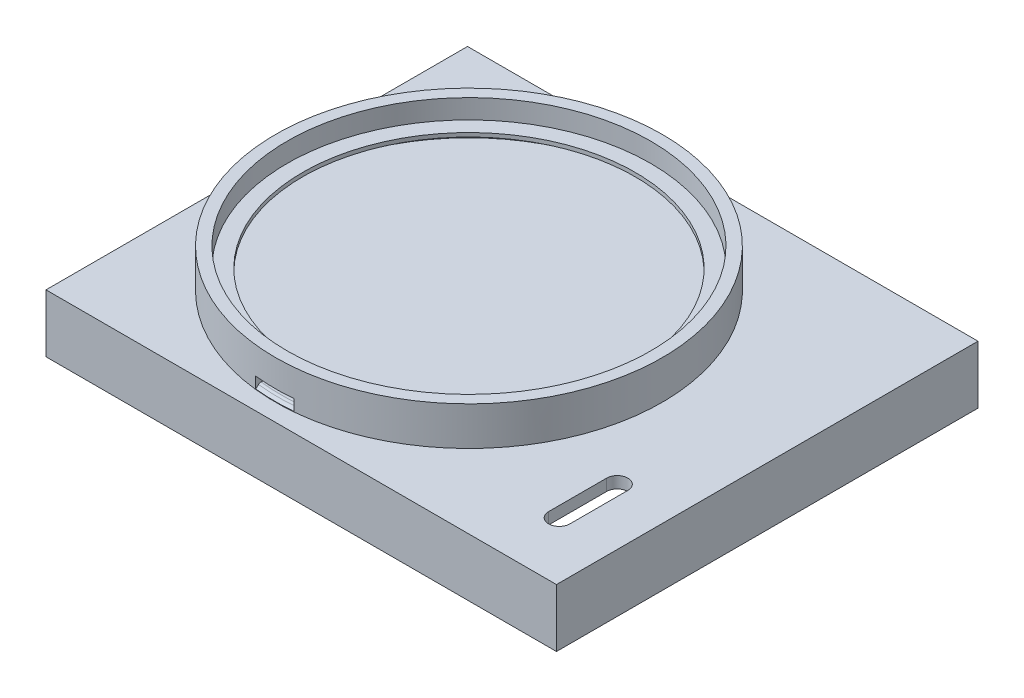
from build123d import *

# Parameters (mm, degrees)
SKETCH1_W            = 132
SKETCH1_H            = 109
BOSS_EXTRUDE1_DEPTH  = 15
SKETCH2_W            = 126
SKETCH2_H            = 103
CUT_EXTRUDE1_DEPTH   = 12
SKETCH3_W            = 18
SKETCH3_H            = 1.5
BOSS_EXTRUDE6_DEPTH  = 3
SKETCH6_W            = 18
SKETCH6_H            = 1.5
BOSS_EXTRUDE7_DEPTH  = 3
CUT_EXTRUDE2_DEPTH   = 10
SKETCH13_R           = 50
BOSS_EXTRUDE10_DEPTH = 4
SKETCH18_R           = 47
CUT_EXTRUDE6_DEPTH   = 3
SKETCH19_R           = 50
BOSS_EXTRUDE11_DEPTH = 6
SKETCH20_R           = 47
CUT_EXTRUDE7_DEPTH   = 5
SKETCH21_R           = 43
CUT_EXTRUDE8_DEPTH   = 3
SKETCH22_W           = 10
SKETCH22_H           = 2
CUT_EXTRUDE10_DEPTH  = 8.2
CHAMFER2_SIZE        = 1.3
CHAMFER2_SIZE2       = 0.9102698
FILLET2_R            = 1
SKETCH23_W           = 10
SKETCH23_H           = 2
CUT_EXTRUDE11_DEPTH  = 8.2
CHAMFER3_SIZE        = 1
CHAMFER3_SIZE2       = 0.869286738
FILLET3_R            = 1
SKETCH24_W           = 10
SKETCH24_H           = 2
CUT_EXTRUDE12_DEPTH  = 8.2
CHAMFER4_SIZE        = 1
CHAMFER4_SIZE2       = 0.869286738
FILLET4_R            = 1


with BuildPart() as part:
    # Sketch1 → Boss-Extrude1 (new body)
    with BuildSketch(Plane(origin=(0, 0, 0), x_dir=(1, 0, 0), z_dir=(0, 1, 0))):
        Rectangle(SKETCH1_W, SKETCH1_H)
    extrude(amount=BOSS_EXTRUDE1_DEPTH)

    # Sketch2 → Cut-Extrude1 (cut)
    with BuildSketch(Plane.XZ):
        Rectangle(SKETCH2_W, SKETCH2_H)
    extrude(amount=-CUT_EXTRUDE1_DEPTH, mode=Mode.SUBTRACT)

    # Sketch3 → Boss-Extrude6 (add)
    with BuildSketch(Plane(origin=(-63, 0, 0), x_dir=(0, 0, -1), z_dir=(1, 0, 0))):
        with Locations((0, 2)):
            Rectangle(SKETCH3_W, SKETCH3_H)
    extrude(amount=BOSS_EXTRUDE6_DEPTH)

    # Sketch6 → Boss-Extrude7 (add)
    with BuildSketch(Plane.ZY.offset(-63)):
        with Locations((0, 2)):
            Rectangle(SKETCH6_W, SKETCH6_H)
    extrude(amount=BOSS_EXTRUDE7_DEPTH)

    # Sketch14 → Cut-Extrude2 (cut)
    with BuildSketch(Plane(origin=(0, 15, 0), x_dir=(1, 0, 0), z_dir=(0, 1, 0))):
        with BuildLine():
            Line((48.646447832, -24.177866046), (48.646447832, -39.177866046))
            ThreePointArc((48.646447832, -39.177866046), (51.396447832, -41.927866046), (54.146447832, -39.177866046))
            Line((54.146447832, -39.177866046), (54.146447832, -24.177866046))
            ThreePointArc((54.146447832, -24.177866046), (51.396447832, -21.427866046), (48.646447832, -24.177866046))
        make_face()
    extrude(amount=-CUT_EXTRUDE2_DEPTH, mode=Mode.SUBTRACT)

    # Sketch13 → Boss-Extrude10 (add)
    with BuildSketch(Plane(origin=(0, 15, 0), x_dir=(1, 0, 0), z_dir=(0, 1, 0))):
        with Locations(Location((-11.133590864, 0, 0), (0, 0, 90))):
            Circle(SKETCH13_R)
    extrude(amount=BOSS_EXTRUDE10_DEPTH)

    # Sketch18 → Cut-Extrude6 (cut)
    with BuildSketch(Plane(origin=(0, 19, 0), x_dir=(1, 0, 0), z_dir=(0, 1, 0))):
        with Locations(Location((-11.133590864, 0, 0), (0, 0, 270))):
            Circle(SKETCH18_R)
    extrude(amount=-CUT_EXTRUDE6_DEPTH, mode=Mode.SUBTRACT)

    # Sketch19 → Boss-Extrude11 (add)
    with BuildSketch(Plane(origin=(0, 19, 0), x_dir=(1, 0, 0), z_dir=(0, 1, 0))):
        with Locations(Location((-11.133590864, 0, 0), (0, 0, 90))):
            Circle(SKETCH19_R)
    extrude(amount=BOSS_EXTRUDE11_DEPTH)

    # Sketch20 → Cut-Extrude7 (cut)
    with BuildSketch(Plane(origin=(0, 25, 0), x_dir=(1, 0, 0), z_dir=(0, 1, 0))):
        with Locations(Location((-11.133590864, 0, 0), (0, 0, 270))):
            Circle(SKETCH20_R)
    extrude(amount=-CUT_EXTRUDE7_DEPTH, mode=Mode.SUBTRACT)

    # Sketch21 → Cut-Extrude8 (cut)
    with BuildSketch(Plane(origin=(0, 20, 0), x_dir=(1, 0, 0), z_dir=(0, 1, 0))):
        with Locations(Location((-11.133590864, 0, 0), (0, 0, 270))):
            Circle(SKETCH21_R)
    extrude(amount=-CUT_EXTRUDE8_DEPTH, mode=Mode.SUBTRACT)

    # Sketch22 → Cut-Extrude10 (cut)
    with BuildSketch(Plane.ZY.offset(66)):
        with Locations((0, 16.991930037)):
            Rectangle(SKETCH22_W, SKETCH22_H)
    extrude(amount=-CUT_EXTRUDE10_DEPTH, mode=Mode.SUBTRACT)

    # Chamfer2
    chamfer2_edges = [part.edges().sort_by_distance(p)[0] for p in [
        (-61.133590864, 15.991930037, 0),
    ]]
    chamfer2_side = [part.faces().sort_by_distance(p)[0] for p in [
        (-59.42592439, 15.991930037, 0),
    ]]
    chamfer(chamfer2_edges, length=CHAMFER2_SIZE, length2=CHAMFER2_SIZE2, reference=chamfer2_side[0])

    # Fillet2
    fillet2_edges = [part.edges().sort_by_distance(p)[0] for p in [
        (-59.833590864, 15.991930037, 0),
    ]]
    fillet(fillet2_edges, radius=FILLET2_R)

    # Sketch23 → Cut-Extrude11 (cut)
    with BuildSketch(Plane(origin=(0, 0, -54.5), x_dir=(-1, 0, 0), z_dir=(0, 0, -1))):
        with Locations((11.721254149, 17)):
            Rectangle(SKETCH23_W, SKETCH23_H)
    extrude(amount=-CUT_EXTRUDE11_DEPTH, mode=Mode.SUBTRACT)

    # Chamfer3
    chamfer3_edges = [part.edges().sort_by_distance(p)[0] for p in [
        (-13.931807962, 16, -49.921638405),
    ]]
    chamfer3_side = [part.faces().sort_by_distance(p)[0] for p in [
        (-11.119691984, 16, -0.208830113),
    ]]
    chamfer(chamfer3_edges, length=CHAMFER3_SIZE, length2=CHAMFER3_SIZE2, reference=chamfer3_side[0])

    # Fillet3
    fillet3_edges = [part.edges().sort_by_distance(p)[0] for p in [
        (-11.724338174, 16, -48.996438826),
    ]]
    fillet(fillet3_edges, radius=FILLET3_R)

    # Sketch24 → Cut-Extrude12 (cut)
    with BuildSketch(Plane.XY.offset(54.5)):
        with Locations((-11.559090934, 17)):
            Rectangle(SKETCH24_W, SKETCH24_H)
    extrude(amount=-CUT_EXTRUDE12_DEPTH, mode=Mode.SUBTRACT)

    # Chamfer4
    chamfer4_edges = [part.edges().sort_by_distance(p)[0] for p in [
        (-11.561234683, 16, 49.998171174),
    ]]
    chamfer4_side = [part.faces().sort_by_distance(p)[0] for p in [
        (-11.120399941, 16, 0.097012581),
    ]]
    chamfer(chamfer4_edges, length=CHAMFER4_SIZE, length2=CHAMFER4_SIZE2, reference=chamfer4_side[0])

    # Fillet4
    fillet4_edges = [part.edges().sort_by_distance(p)[0] for p in [
        (-11.56132378, 16, 48.998133072),
    ]]
    fillet(fillet4_edges, radius=FILLET4_R)


solid = part.part
